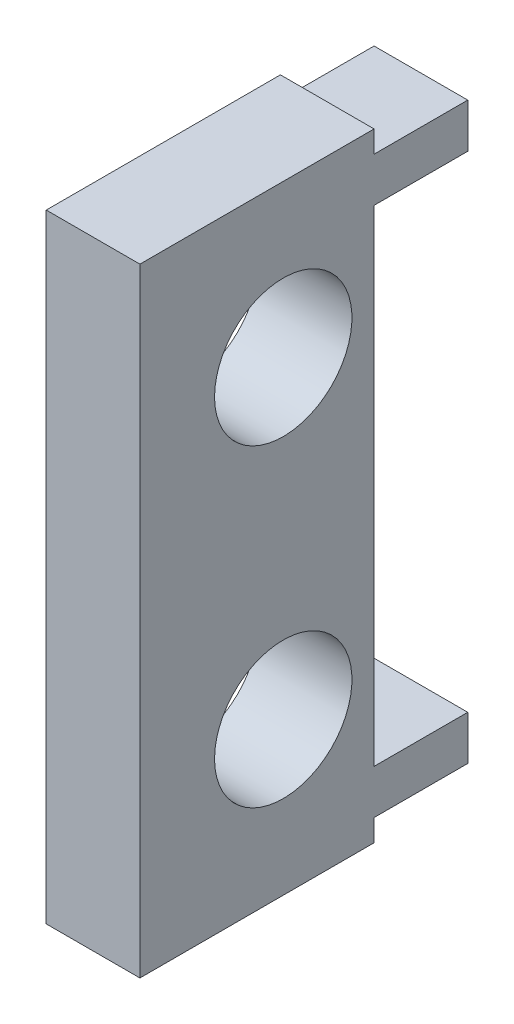
from build123d import *

# Parameters (mm, degrees)
CROQUIS1_W              = 3
CROQUIS1_H              = 19.8
SALIENTE_EXTRUIR1_DEPTH = 7.5
CROQUIS2_W              = 3
CROQUIS2_H              = 1.42
SALIENTE_EXTRUIR2_DEPTH = 3
CROQUIS3_R              = 2.2
CORTAR_EXTRUIR1_DEPTH   = 3


with BuildPart() as part:
    # Croquis1 → Saliente-Extruir1 (new body)
    with BuildSketch(Plane.XY):
        Rectangle(CROQUIS1_W, CROQUIS1_H)
    extrude(amount=SALIENTE_EXTRUIR1_DEPTH)

    # Croquis2 → Saliente-Extruir2 (add)
    with BuildSketch(Plane(origin=(0, 0, 0), x_dir=(-1, 0, 0), z_dir=(0, 0, -1))):
        with Locations((0, 8.49)):
            Rectangle(CROQUIS2_W, CROQUIS2_H)
        with Locations((0, -8.49)):
            Rectangle(CROQUIS2_W, CROQUIS2_H)
    extrude(amount=SALIENTE_EXTRUIR2_DEPTH)

    # Croquis3 → Cortar-Extruir1 (cut)
    with BuildSketch(Plane.ZY.offset(1.5)):
        with Locations((2.91, -5.02)):
            Circle(CROQUIS3_R)
        with Locations((2.91, 5.02)):
            Circle(CROQUIS3_R)
    extrude(amount=-CORTAR_EXTRUIR1_DEPTH, mode=Mode.SUBTRACT)


solid = part.part
